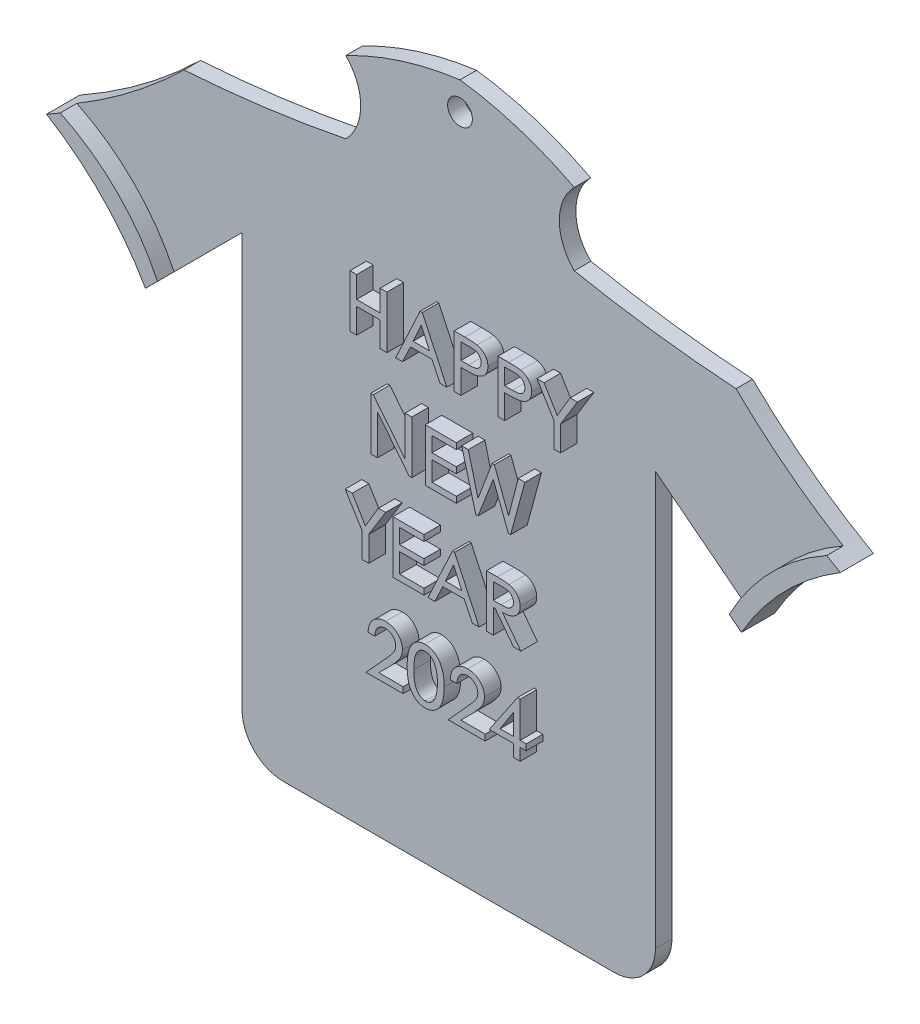
from build123d import *

# Parameters (mm, degrees)
BOSS_EXTRUDE1_DEPTH = 5
SKETCH4_R           = 1.5
CUT_EXTRUDE1_DEPTH  = 5
BOSS_EXTRUDE2_DEPTH = 2
BOSS_EXTRUDE3_DEPTH = 2
CUT_EXTRUDE2_DEPTH  = 3


with BuildPart() as part:
    # Sketch2 → Boss-Extrude1 (new body)
    with BuildSketch(Plane.XY):
        with BuildLine():
            Line((0, 55), (-9.681818182, 45.318181818))
            ThreePointArc((-9.681818182, 45.318181818), (-14.887109435, 52.206720352), (-21.650081289, 57.574143557))
            ThreePointArc((-21.650081289, 57.574143557), (-13.979715501, 62.568990284), (-7.026662114, 68.521977243))
            ThreePointArc((-7.026662114, 68.521977243), (2.800987049, 69.489571918), (12.545454545, 71.090909091))
            ThreePointArc((12.545454545, 71.090909091), (14.352931909, 75.454545455), (12.545454545, 79.818181818))
            ThreePointArc((12.545454545, 79.818181818), (19.262496668, 82.608154491), (26.363636364, 84.181818182))
            ThreePointArc((26.363636364, 84.181818182), (33.464776059, 82.608154491), (40.181818182, 79.818181818))
            ThreePointArc((40.181818182, 79.818181818), (38.374340819, 75.454545455), (40.181818182, 71.090909091))
            ThreePointArc((40.181818182, 71.090909091), (49.926285678, 69.489571918), (59.753934841, 68.521977243))
            ThreePointArc((59.753934841, 68.521977243), (66.706988228, 62.568990284), (74.377354016, 57.574143557))
            ThreePointArc((74.377354016, 57.574143557), (67.614382163, 52.206720352), (62.409090909, 45.318181818))
            Line((62.409090909, 45.318181818), (50, 55))
            Line((50, 55), (50, 5))
            ThreePointArc((50, 5), (48.535533906, 1.464466094), (45, 0))
            Line((45, 0), (5, 0))
            ThreePointArc((5, 0), (1.464466094, 1.464466094), (0, 5))
            Line((0, 5), (0, 55))
        make_face()
    extrude(amount=BOSS_EXTRUDE1_DEPTH)

    # Sketch4 → Cut-Extrude1 (cut)
    with BuildSketch(Plane.XY.offset(5)):
        with Locations((26.363636364, 80.815512025)):
            Circle(SKETCH4_R)
    extrude(amount=-CUT_EXTRUDE1_DEPTH, mode=Mode.SUBTRACT)

    # Sketch5 → Boss-Extrude2 (add)
    # profile 1 of 16: a face of its own
    with BuildSketch(Plane.XY.offset(5)):
        Polygon((15.047921928, 59.532880786), (15.862024492, 59.532880786), (15.862024492, 56.927752581), (18.711383467, 56.927752581), (18.711383467, 59.532880786), (19.525486031, 59.532880786), (19.525486031, 53.182880786), (18.711383467, 53.182880786), (18.711383467, 56.195060273), (15.862024492, 56.195060273), (15.862024492, 53.182880786), (15.047921928, 53.182880786), align=None)
    # profile 2 of 16: a face of its own
    with BuildSketch(Plane.XY.offset(5)):
        Polygon((23.799524492, 59.532880786), (26.770998851, 53.182880786), (25.935271688, 53.182880786), (24.971068963, 55.218137196), (22.37357297, 55.218137196), (21.409370246, 53.182880786), (20.583819364, 53.182880786), (23.545117441, 59.532880786), align=None)
        Polygon((23.672320967, 58.145090321), (22.683949572, 55.950829504), (24.670868643, 55.950829504), align=None, mode=Mode.SUBTRACT)
    # profile 3 of 16: a face of its own
    with BuildSketch(Plane.XY.offset(5)):
        with BuildLine():
            Line((27.666511672, 59.532880786), (28.967803739, 59.532880786))
            add(Edge.make_bspline(
                [(28.967803739, 59.532880786), (29.053883131, 59.532833891), (29.218850574, 59.53274402), (29.45543153, 59.526654045), (29.67006373, 59.521397891), (29.863064306, 59.511295115), (30.033993841, 59.497456249), (30.182913697, 59.4811834), (30.309983771, 59.46288094), (30.386616983, 59.446334056), (30.421740037, 59.438750177)],
                knots=[0, 0, 0, 0, 1.415450773, 2.712650385, 3.891531898, 4.945867971, 5.890285756, 6.71109784, 7.409261617, 8, 8, 8, 8], degree=3))
            add(Edge.make_bspline(
                [(30.421740037, 59.438750177), (30.471184061, 59.426035366), (30.568721965, 59.400952943), (30.708156028, 59.34925065), (30.840460118, 59.290501653), (30.965182525, 59.223672681), (31.081049258, 59.146488802), (31.190560085, 59.062629726), (31.290346616, 58.967853979), (31.383827456, 58.866759343), (31.465848084, 58.757036736), (31.539338803, 58.64239884), (31.600251432, 58.521180572), (31.650311307, 58.393832822), (31.689444922, 58.261019556), (31.717594296, 58.12231761), (31.73450895, 57.978031135), (31.736175619, 57.879705233), (31.737024492, 57.829625577)],
                knots=[0, 0, 0, 0, 1.085641105, 2.141637125, 3.15936318, 4.164535163, 5.147931294, 6.118832473, 7.09541784, 8.072503165, 9.045079613, 10.006206652, 10.966486436, 11.926469503, 12.914201526, 13.908586125, 14.934794539, 16, 16, 16, 16], degree=3))
            add(Edge.make_bspline(
                [(31.737024492, 57.829625577), (31.736156995, 57.779548255), (31.734446461, 57.680805549), (31.717638619, 57.53565651), (31.689463736, 57.396666427), (31.651478741, 57.263221287), (31.60155803, 57.136151007), (31.541906913, 57.014382814), (31.469800152, 56.899296314), (31.387481782, 56.790092684), (31.294520852, 56.688450149), (31.192264624, 56.594754505), (31.07936897, 56.510642107), (30.956991768, 56.434603227), (30.825559442, 56.36530448), (30.683749772, 56.305699952), (30.532195439, 56.254911217), (30.427013313, 56.227905455), (30.373402697, 56.214140802)],
                knots=[0, 0, 0, 0, 1.042501879, 2.055610221, 3.037454288, 3.993184118, 4.940927036, 5.876790881, 6.812738028, 7.76458517, 8.720845088, 9.677105007, 10.648370915, 11.647960469, 12.67482723, 13.739162042, 14.847666245, 16, 16, 16, 16], degree=3))
            add(Edge.make_bspline(
                [(30.373402697, 56.214140802), (30.334056679, 56.205610302), (30.248224151, 56.187001192), (30.105790236, 56.16763708), (29.939825649, 56.151772856), (29.749805849, 56.137970688), (29.536509725, 56.126376743), (29.298991184, 56.119475146), (29.037791939, 56.113906068), (28.855444278, 56.113737711), (28.760461992, 56.113650016)],
                knots=[0, 0, 0, 0, 0.596754895, 1.30180848, 2.129432098, 3.068723067, 4.126429569, 5.296393252, 6.591729958, 8, 8, 8, 8], degree=3))
            Line((28.760461992, 56.113650016), (28.480614236, 56.113650016))
            Line((28.480614236, 56.113650016), (28.480614236, 53.182880786))
            Line((28.480614236, 53.182880786), (27.666511672, 53.182880786))
            Line((27.666511672, 53.182880786), (27.666511672, 59.532880786))
        make_face()
        with BuildLine():
            Line((28.480614236, 58.800188478), (28.480614236, 56.843798254))
            Line((28.480614236, 56.843798254), (29.396479621, 56.833621972))
            add(Edge.make_bspline(
                [(29.396479621, 56.833621972), (29.448210988, 56.834304118), (29.547881044, 56.8356184), (29.691712724, 56.840181741), (29.824007324, 56.849456423), (29.945020391, 56.860273312), (30.054996389, 56.875438641), (30.153440213, 56.894365705), (30.241191266, 56.915631287), (30.341535845, 56.949065489), (30.453855925, 57.001270348), (30.573264441, 57.080924166), (30.67851893, 57.176184262), (30.765443265, 57.288305209), (30.835396369, 57.41184043), (30.887394278, 57.543876775), (30.91682603, 57.684169677), (30.920872747, 57.779885075), (30.922921928, 57.828353542)],
                knots=[0, 0, 0, 0, 1.196816259, 2.305888068, 3.328295896, 4.264290022, 5.116006351, 5.89509982, 6.582615619, 7.202969204, 8.339503699, 9.435837163, 10.511976311, 11.608836183, 12.702577786, 13.786378287, 14.879063815, 16, 16, 16, 16], degree=3))
            add(Edge.make_bspline(
                [(30.922921928, 57.828353542), (30.920857945, 57.875130584), (30.916764111, 57.967911089), (30.887178512, 58.104367601), (30.835156605, 58.233800828), (30.765089562, 58.355600708), (30.67994494, 58.466927624), (30.579087084, 58.562696299), (30.464943911, 58.640965983), (30.358382477, 58.691096332), (30.263366564, 58.723720236), (30.179623697, 58.742884502), (30.085019843, 58.760802825), (29.97896754, 58.776163868), (29.861368123, 58.787242505), (29.732363354, 58.794348851), (29.592420901, 58.799917788), (29.495280742, 58.800095933), (29.44481696, 58.800188478)],
                knots=[0, 0, 0, 0, 1.113934591, 2.209447376, 3.306634974, 4.424089692, 5.547326231, 6.633252657, 7.723023745, 8.829884498, 9.427152571, 10.113060991, 10.873719268, 11.720735618, 12.664423995, 13.686322671, 14.798057257, 16, 16, 16, 16], degree=3))
            Line((29.44481696, 58.800188478), (28.480614236, 58.800188478))
        make_face(mode=Mode.SUBTRACT)
    # profile 4 of 16: a face of its own
    with BuildSketch(Plane.XY.offset(5)):
        with BuildLine():
            Line((32.958178338, 59.532880786), (34.259470406, 59.532880786))
            add(Edge.make_bspline(
                [(34.259470406, 59.532880786), (34.345549797, 59.532833891), (34.51051724, 59.53274402), (34.747098196, 59.526654045), (34.961730397, 59.521397891), (35.154730972, 59.511295115), (35.325660508, 59.497456249), (35.474580364, 59.4811834), (35.601650437, 59.46288094), (35.67828365, 59.446334056), (35.713406704, 59.438750177)],
                knots=[0, 0, 0, 0, 1.415450773, 2.712650385, 3.891531898, 4.945867971, 5.890285756, 6.71109784, 7.409261617, 8, 8, 8, 8], degree=3))
            add(Edge.make_bspline(
                [(35.713406704, 59.438750177), (35.762850728, 59.426035366), (35.860388632, 59.400952943), (35.999822695, 59.34925065), (36.132126785, 59.290501653), (36.256849191, 59.223672681), (36.372715925, 59.146488802), (36.482226751, 59.062629726), (36.582013282, 58.967853979), (36.675494123, 58.866759343), (36.757514751, 58.757036736), (36.83100547, 58.64239884), (36.891918099, 58.521180572), (36.941977974, 58.393832822), (36.981111589, 58.261019556), (37.009260962, 58.12231761), (37.026175617, 57.978031135), (37.027842286, 57.879705233), (37.028691159, 57.829625577)],
                knots=[0, 0, 0, 0, 1.085641105, 2.141637125, 3.15936318, 4.164535163, 5.147931294, 6.118832473, 7.09541784, 8.072503165, 9.045079613, 10.006206652, 10.966486436, 11.926469503, 12.914201526, 13.908586125, 14.934794539, 16, 16, 16, 16], degree=3))
            add(Edge.make_bspline(
                [(37.028691159, 57.829625577), (37.027823662, 57.779548255), (37.026113128, 57.680805549), (37.009305286, 57.53565651), (36.981130402, 57.396666427), (36.943145407, 57.263221287), (36.893224697, 57.136151007), (36.83357358, 57.014382814), (36.761466819, 56.899296314), (36.679148449, 56.790092684), (36.586187519, 56.688450149), (36.483931291, 56.594754505), (36.371035637, 56.510642107), (36.248658435, 56.434603227), (36.117226109, 56.36530448), (35.975416439, 56.305699952), (35.823862106, 56.254911217), (35.71867998, 56.227905455), (35.665069364, 56.214140802)],
                knots=[0, 0, 0, 0, 1.042501879, 2.055610221, 3.037454288, 3.993184118, 4.940927036, 5.876790881, 6.812738028, 7.76458517, 8.720845088, 9.677105007, 10.648370915, 11.647960469, 12.67482723, 13.739162042, 14.847666245, 16, 16, 16, 16], degree=3))
            add(Edge.make_bspline(
                [(35.665069364, 56.214140802), (35.625723345, 56.205610302), (35.539890818, 56.187001192), (35.397456903, 56.16763708), (35.231492316, 56.151772856), (35.041472516, 56.137970688), (34.828176391, 56.126376743), (34.590657851, 56.119475146), (34.329458606, 56.113906068), (34.147110945, 56.113737711), (34.052128659, 56.113650016)],
                knots=[0, 0, 0, 0, 0.596754895, 1.30180848, 2.129432098, 3.068723067, 4.126429569, 5.296393252, 6.591729958, 8, 8, 8, 8], degree=3))
            Line((34.052128659, 56.113650016), (33.772280903, 56.113650016))
            Line((33.772280903, 56.113650016), (33.772280903, 53.182880786))
            Line((33.772280903, 53.182880786), (32.958178338, 53.182880786))
            Line((32.958178338, 53.182880786), (32.958178338, 59.532880786))
        make_face()
        with BuildLine():
            Line((33.772280903, 58.800188478), (33.772280903, 56.843798254))
            Line((33.772280903, 56.843798254), (34.688146287, 56.833621972))
            add(Edge.make_bspline(
                [(34.688146287, 56.833621972), (34.739877655, 56.834304118), (34.839547711, 56.8356184), (34.983379391, 56.840181741), (35.11567399, 56.849456423), (35.236687058, 56.860273312), (35.346663056, 56.875438641), (35.44510688, 56.894365705), (35.532857933, 56.915631287), (35.633202511, 56.949065489), (35.745522592, 57.001270348), (35.864931107, 57.080924166), (35.970185597, 57.176184262), (36.057109931, 57.288305209), (36.127063036, 57.41184043), (36.179060945, 57.543876775), (36.208492696, 57.684169677), (36.212539414, 57.779885075), (36.214588595, 57.828353542)],
                knots=[0, 0, 0, 0, 1.196816259, 2.305888068, 3.328295896, 4.264290022, 5.116006351, 5.89509982, 6.582615619, 7.202969204, 8.339503699, 9.435837163, 10.511976311, 11.608836183, 12.702577786, 13.786378287, 14.879063815, 16, 16, 16, 16], degree=3))
            add(Edge.make_bspline(
                [(36.214588595, 57.828353542), (36.212524611, 57.875130584), (36.208430778, 57.967911089), (36.178845178, 58.104367601), (36.126823272, 58.233800828), (36.056756228, 58.355600708), (35.971611606, 58.466927624), (35.870753751, 58.562696299), (35.756610578, 58.640965983), (35.650049144, 58.691096332), (35.55503323, 58.723720236), (35.471290363, 58.742884502), (35.37668651, 58.760802825), (35.270634207, 58.776163868), (35.15303479, 58.787242505), (35.02403002, 58.794348851), (34.884087568, 58.799917788), (34.786947409, 58.800095933), (34.736483627, 58.800188478)],
                knots=[0, 0, 0, 0, 1.113934591, 2.209447376, 3.306634974, 4.424089692, 5.547326231, 6.633252657, 7.723023745, 8.829884498, 9.427152571, 10.113060991, 10.873719268, 11.720735618, 12.664423995, 13.686322671, 14.798057257, 16, 16, 16, 16], degree=3))
            Line((34.736483627, 58.800188478), (33.772280903, 58.800188478))
        make_face(mode=Mode.SUBTRACT)
    # profile 5 of 16: a face of its own
    with BuildSketch(Plane.XY.offset(5)):
        Polygon((37.67997321, 59.532880786), (38.533508867, 59.532880786), (40.115920726, 56.90103984), (41.69706055, 59.532880786), (42.564588595, 59.532880786), (40.529332185, 56.223045048), (40.529332185, 53.182880786), (39.715229621, 53.182880786), (39.715229621, 56.200148414), align=None)
    # profile 6 of 16: a face of its own
    with BuildSketch(Plane.XY.offset(5)):
        Polygon((17.571639877, 41.599547452), (17.571639877, 47.949547452), (17.873112233, 47.949547452), (21.723562954, 43.124717725), (21.723562954, 47.949547452), (22.537665518, 47.949547452), (22.537665518, 41.599547452), (22.204392281, 41.599547452), (18.385742441, 46.411656827), (18.385742441, 41.599547452), align=None)
    # profile 7 of 16: a face of its own
    with BuildSketch(Plane.XY.offset(5)):
        Polygon((24.165870646, 47.949547452), (27.910742441, 47.949547452), (27.910742441, 47.216855145), (24.97997321, 47.216855145), (24.97997321, 45.425829504), (27.910742441, 45.425829504), (27.910742441, 44.693137196), (24.97997321, 44.693137196), (24.97997321, 42.33223976), (27.910742441, 42.33223976), (27.910742441, 41.599547452), (24.165870646, 41.599547452), align=None)
    # profile 8 of 16: a face of its own
    with BuildSketch(Plane.XY.offset(5)):
        Polygon((28.562024492, 47.949547452), (29.371038915, 47.949547452), (30.534951175, 43.412197693), (32.258558947, 47.949547452), (32.524414316, 47.949547452), (34.235301736, 43.42110194), (35.405574172, 47.949547452), (36.214588595, 47.949547452), (34.487164717, 41.599547452), (34.209861031, 41.599547452), (32.384490438, 46.334062677), (30.547671528, 41.599547452), (30.272911912, 41.599547452), align=None)
    # profile 9 of 16: a face of its own
    with BuildSketch(Plane.XY.offset(5)):
        Polygon((14.478050133, 36.366214119), (15.33158579, 36.366214119), (16.913997649, 33.734373173), (18.495137473, 36.366214119), (19.362665518, 36.366214119), (17.327409108, 33.056378382), (17.327409108, 30.016214119), (16.513306544, 30.016214119), (16.513306544, 33.033481747), align=None)
    # profile 10 of 16: a face of its own
    with BuildSketch(Plane.XY.offset(5)):
        Polygon((20.258178338, 36.366214119), (24.003050133, 36.366214119), (24.003050133, 35.633521811), (21.072280903, 35.633521811), (21.072280903, 33.84249617), (24.003050133, 33.84249617), (24.003050133, 33.109803863), (21.072280903, 33.109803863), (21.072280903, 30.748906427), (24.003050133, 30.748906427), (24.003050133, 30.016214119), (20.258178338, 30.016214119), align=None)
    # profile 11 of 16: a face of its own
    with BuildSketch(Plane.XY.offset(5)):
        Polygon((27.7072168, 36.366214119), (30.678691159, 30.016214119), (29.842963996, 30.016214119), (28.878761271, 32.051470529), (26.281265278, 32.051470529), (25.317062553, 30.016214119), (24.491511672, 30.016214119), (27.452809749, 36.366214119), align=None)
        Polygon((27.580013274, 34.978423654), (26.59164188, 32.784162837), (28.578560951, 32.784162837), align=None, mode=Mode.SUBTRACT)
    # profile 12 of 16: a face of its own
    with BuildSketch(Plane.XY.offset(5)):
        with BuildLine():
            Line((31.574203979, 36.366214119), (32.874224012, 36.366214119))
            add(Edge.make_bspline(
                [(32.874224012, 36.366214119), (32.957756991, 36.366012143), (33.117624137, 36.365625598), (33.347020824, 36.361569331), (33.555306912, 36.356197165), (33.742639821, 36.344975489), (33.909521205, 36.335070279), (34.055229275, 36.318778984), (34.180450038, 36.304248913), (34.255736636, 36.288262917), (34.289999252, 36.280987757)],
                knots=[0, 0, 0, 0, 1.411347063, 2.701065231, 3.876524531, 4.931206492, 5.871916627, 6.700262025, 7.408494688, 8, 8, 8, 8], degree=3))
            add(Edge.make_bspline(
                [(34.289999252, 36.280987757), (34.341087422, 36.268144836), (34.441738899, 36.242842325), (34.586747339, 36.193027045), (34.723648286, 36.134298404), (34.852261304, 36.066979411), (34.972895629, 35.990731934), (35.083217392, 35.903255762), (35.187572611, 35.809019261), (35.281934753, 35.705065863), (35.367790031, 35.594523699), (35.44119854, 35.47741225), (35.504183689, 35.355304327), (35.556751886, 35.228381445), (35.596057995, 35.095228229), (35.623589647, 34.956824667), (35.642537168, 34.813581811), (35.643985626, 34.71602247), (35.6447168, 34.666775016)],
                knots=[0, 0, 0, 0, 1.103820101, 2.174693741, 3.209859002, 4.223626675, 5.214778413, 6.196198804, 7.171320727, 8.158999421, 9.134971582, 10.10159085, 11.051641808, 12.012235658, 12.97676874, 13.956376421, 14.968389326, 16, 16, 16, 16], degree=3))
            add(Edge.make_bspline(
                [(35.6447168, 34.666775016), (35.641994908, 34.585554987), (35.636645469, 34.425930191), (35.58802968, 34.193129371), (35.508362072, 33.973680503), (35.417492907, 33.802252305), (35.329093548, 33.674805919), (35.255083897, 33.584201315), (35.173718323, 33.499318786), (35.085573759, 33.419274622), (34.988330546, 33.347606031), (34.884955228, 33.27965299), (34.774228352, 33.217184981), (34.614621493, 33.142176644), (34.398743864, 33.063996802), (34.119813469, 32.996973098), (33.818408056, 32.956260845), (33.610013506, 32.950138654), (33.502609428, 32.94698335)],
                knots=[0, 0, 0, 0, 1.258986715, 2.474334223, 3.670931197, 4.871716255, 5.472099774, 6.075216246, 6.684756624, 7.295006596, 7.919971941, 8.55677058, 9.213641309, 9.890468445, 11.291088691, 12.766994829, 14.333747493, 16, 16, 16, 16], degree=3))
            Line((33.502609428, 32.94698335), (35.726127056, 30.016214119))
            Line((35.726127056, 30.016214119), (34.829342201, 30.016214119))
            Line((34.829342201, 30.016214119), (32.605824572, 32.94698335))
            Line((32.605824572, 32.94698335), (32.388306544, 32.94698335))
            Line((32.388306544, 32.94698335), (32.388306544, 30.016214119))
            Line((32.388306544, 30.016214119), (31.574203979, 30.016214119))
            Line((31.574203979, 30.016214119), (31.574203979, 36.366214119))
        make_face()
        with BuildLine():
            Line((32.388306544, 35.633521811), (32.388306544, 33.678403622))
            Line((32.388306544, 33.678403622), (33.321980422, 33.672043446))
            add(Edge.make_bspline(
                [(33.321980422, 33.672043446), (33.372018496, 33.672172734), (33.468731388, 33.67242262), (33.608721622, 33.677568105), (33.738565944, 33.686184368), (33.857751458, 33.698945566), (33.965932467, 33.714170104), (34.063938212, 33.731221716), (34.150848439, 33.754246834), (34.252370499, 33.787436707), (34.365162786, 33.840759375), (34.484814499, 33.921945354), (34.589693449, 34.018026968), (34.675699619, 34.130609623), (34.744513751, 34.254125193), (34.794574459, 34.386002649), (34.824730654, 34.525498642), (34.828630719, 34.620833264), (34.830614236, 34.669319087)],
                knots=[0, 0, 0, 0, 1.165824803, 2.253289887, 3.263370799, 4.197285623, 5.045371766, 5.808848116, 6.513348392, 7.138183875, 8.296069948, 9.40583476, 10.496436725, 11.595152671, 12.691956992, 13.780050175, 14.870965332, 16, 16, 16, 16], degree=3))
            add(Edge.make_bspline(
                [(34.830614236, 34.669319087), (34.828536882, 34.716090552), (34.824416529, 34.808859993), (34.795110809, 34.945010979), (34.742727726, 35.073456207), (34.673227297, 35.19403057), (34.587112904, 35.302425772), (34.488079387, 35.397940646), (34.373675134, 35.473649477), (34.268348702, 35.52474785), (34.173953096, 35.556794831), (34.09036974, 35.576585699), (33.99523278, 35.594060526), (33.888347832, 35.609419427), (33.769912434, 35.6206408), (33.639631155, 35.627700504), (33.497568287, 35.633247419), (33.398732818, 35.63342804), (33.347421127, 35.633521811)],
                knots=[0, 0, 0, 0, 1.114111647, 2.20979856, 3.297775031, 4.406653707, 5.514151176, 6.585969385, 7.670234779, 8.768154562, 9.365517569, 10.041721951, 10.812428959, 11.669578816, 12.61341719, 13.645562296, 14.777663698, 16, 16, 16, 16], degree=3))
            Line((33.347421127, 35.633521811), (32.388306544, 35.633521811))
        make_face(mode=Mode.SUBTRACT)
    # profile 13 of 16: a face of its own
    with BuildSketch(Plane.XY.offset(5)):
        with BuildLine():
            Line((18.051197169, 22.747624375), (17.245998851, 22.747624375))
            add(Edge.make_bspline(
                [(17.245998851, 22.747624375), (17.24978111, 22.829557634), (17.257178689, 22.989807846), (17.290027756, 23.22331031), (17.343240903, 23.443329195), (17.410407129, 23.651729673), (17.500005002, 23.845906629), (17.603383025, 24.029245063), (17.728184051, 24.197902564), (17.869216028, 24.352145933), (18.022311221, 24.492282036), (18.186889269, 24.613118736), (18.360168298, 24.716089447), (18.542182382, 24.80011423), (18.733287976, 24.865173014), (18.932940355, 24.912514661), (19.141776434, 24.940989537), (19.284134698, 24.944116193), (19.356305342, 24.945701298)],
                knots=[0, 0, 0, 0, 1.154964179, 2.258951466, 3.315045469, 4.34063582, 5.337653555, 6.322213479, 7.300594401, 8.285733883, 9.262436119, 10.219305053, 11.156568068, 12.097250375, 13.037875795, 13.995471444, 14.983774372, 16, 16, 16, 16], degree=3))
            add(Edge.make_bspline(
                [(19.356305342, 24.945701298), (19.431868161, 24.94415561), (19.580143307, 24.941122543), (19.796067633, 24.91258101), (20.000420242, 24.866557809), (20.19326097, 24.803706662), (20.374238473, 24.719784011), (20.543709629, 24.618582549), (20.700045398, 24.496942047), (20.844380456, 24.36083392), (20.971865633, 24.211113859), (21.087010932, 24.057183852), (21.18218967, 23.895922022), (21.26192546, 23.730273047), (21.323283407, 23.558877376), (21.366614198, 23.382432515), (21.392587398, 23.200818566), (21.396132463, 23.078013108), (21.397921928, 23.016023815)],
                knots=[0, 0, 0, 0, 1.156722346, 2.269809107, 3.328396062, 4.361258308, 5.3694338, 6.377253737, 7.377324894, 8.397019439, 9.4098266, 10.385180797, 11.337325354, 12.27255833, 13.196816462, 14.119704983, 15.050871513, 16, 16, 16, 16], degree=3))
            add(Edge.make_bspline(
                [(21.397921928, 23.016023815), (21.394665643, 22.929310966), (21.38819768, 22.757073165), (21.338392365, 22.502257224), (21.254663795, 22.2556486), (21.157949286, 22.054844501), (21.060134228, 21.892531687), (20.97037002, 21.758557035), (20.864920298, 21.613689767), (20.741523642, 21.458899634), (20.605086803, 21.290644978), (20.450189975, 21.113266247), (20.281627447, 20.923172284), (20.161411275, 20.795171799), (20.099173931, 20.728904423)],
                knots=[0, 0, 0, 0, 1.155755081, 2.295677249, 3.447123235, 4.6205014, 5.259503175, 5.973005395, 6.77029923, 7.648035671, 8.612336498, 9.658570495, 10.787814065, 12, 12, 12, 12], degree=3))
            Line((20.099173931, 20.728904423), (18.537114637, 19.165573093))
            Line((18.537114637, 19.165573093), (21.479332185, 19.165573093))
            Line((21.479332185, 19.165573093), (21.479332185, 18.432880786))
            Line((21.479332185, 18.432880786), (17.001768082, 18.432880786))
            Line((17.001768082, 18.432880786), (19.431355422, 21.115603141))
            add(Edge.make_bspline(
                [(19.431355422, 21.115603141), (19.489224972, 21.177320368), (19.600277695, 21.295756854), (19.756790787, 21.469128851), (19.898000634, 21.629408557), (20.024660081, 21.776480266), (20.133452434, 21.912320778), (20.227304423, 22.034931643), (20.305153626, 22.144891852), (20.386000395, 22.274324171), (20.46611125, 22.429478325), (20.534260105, 22.618744607), (20.575152756, 22.812026536), (20.580929081, 22.942056735), (20.583819364, 23.007119568)],
                knots=[0, 0, 0, 0, 1.341560447, 2.574479018, 3.703506985, 4.728875774, 5.651874962, 6.462761537, 7.177175968, 7.787249671, 8.88179658, 9.938774664, 10.968630673, 12, 12, 12, 12], degree=3))
            add(Edge.make_bspline(
                [(20.583819364, 23.007119568), (20.583107077, 23.047482086), (20.581697673, 23.127347502), (20.562482766, 23.244300827), (20.535415119, 23.357739044), (20.493550936, 23.465838409), (20.443112299, 23.570725659), (20.380022537, 23.671044898), (20.304262951, 23.765865556), (20.219987541, 23.857321039), (20.126776723, 23.939894981), (20.028323824, 24.013951729), (19.92341811, 24.074095443), (19.814927863, 24.126692173), (19.699480597, 24.163979814), (19.579914145, 24.191742379), (19.45528967, 24.210974069), (19.37037183, 24.21232154), (19.327048531, 24.213008991)],
                knots=[0, 0, 0, 0, 0.999432927, 1.977580462, 2.931018689, 3.885672852, 4.844657058, 5.812871023, 6.815890212, 7.849665183, 8.891901864, 9.898878619, 10.897592748, 11.885014695, 12.882178885, 13.896915602, 14.927050508, 16, 16, 16, 16], degree=3))
            add(Edge.make_bspline(
                [(19.327048531, 24.213008991), (19.285861289, 24.212164233), (19.204835171, 24.210502371), (19.085504157, 24.193355812), (18.970961158, 24.165437841), (18.860819769, 24.12671307), (18.754282257, 24.078937911), (18.653953642, 24.017045285), (18.558194084, 23.945045092), (18.465737617, 23.864235713), (18.38159157, 23.769430223), (18.306329181, 23.661752088), (18.239869521, 23.541083979), (18.183062837, 23.407636991), (18.135984363, 23.261061024), (18.098218179, 23.101534308), (18.069021269, 22.928987418), (18.057248446, 22.80919708), (18.051197169, 22.747624375)],
                knots=[0, 0, 0, 0, 0.911540883, 1.79324023, 2.663162255, 3.518366492, 4.375475705, 5.243419306, 6.122264358, 7.02676621, 7.957780629, 8.921596253, 9.930241338, 11.002848587, 12.128200329, 13.335197372, 14.630280975, 16, 16, 16, 16], degree=3))
        make_face()
    # profile 14 of 16: a face of its own
    with BuildSketch(Plane.XY.offset(5)):
        with BuildLine():
            add(Edge.make_bspline(
                [(21.967793723, 21.605336715), (21.968399799, 21.706264004), (21.969576823, 21.902268739), (21.982259769, 22.187405427), (22.004138791, 22.455049017), (22.032241624, 22.705207451), (22.071121149, 22.938052602), (22.115607379, 23.153699535), (22.170368566, 23.352174779), (22.234331509, 23.533832494), (22.30614903, 23.701898981), (22.385112735, 23.858479432), (22.47072251, 24.005561839), (22.562400152, 24.143094974), (22.664479906, 24.268014792), (22.770968996, 24.384599438), (22.885865837, 24.490573085), (23.008117502, 24.585405188), (23.134580275, 24.671142477), (23.266749487, 24.743407579), (23.401562721, 24.806357369), (23.540739149, 24.857278285), (23.683269677, 24.896834129), (23.829664754, 24.924458179), (23.979228255, 24.943481278), (24.080584651, 24.944958737), (24.131525694, 24.945701298)],
                knots=[0, 0, 0, 0, 1.622528522, 3.151013738, 4.587225782, 5.939257941, 7.196658267, 8.381214254, 9.47772444, 10.503964975, 11.475138444, 12.414102326, 13.321377868, 14.209997518, 15.068075989, 15.912287155, 16.746865696, 17.577313739, 18.397854368, 19.200328723, 19.996378645, 20.787862277, 21.580050128, 22.371504404, 23.181529048, 24, 24, 24, 24], degree=3))
            add(Edge.make_bspline(
                [(24.131525694, 24.945701298), (24.187096809, 24.944237891), (24.296784321, 24.941349384), (24.459565878, 24.925629956), (24.616889748, 24.893871481), (24.77091449, 24.854045117), (24.919145288, 24.799601616), (25.064518409, 24.736994085), (25.202559351, 24.657695786), (25.337976412, 24.570954219), (25.46612654, 24.470924063), (25.588697053, 24.362234295), (25.701866481, 24.241174779), (25.809760055, 24.111911144), (25.906843456, 23.969380899), (25.999264035, 23.81857484), (26.081096558, 23.655737185), (26.158737767, 23.483748526), (26.225475003, 23.298035688), (26.285878584, 23.099659224), (26.334829078, 22.886147597), (26.375435157, 22.658164354), (26.406727904, 22.415325668), (26.429838398, 22.158208373), (26.441904299, 21.886572088), (26.44418617, 21.700749669), (26.445357826, 21.605336715)],
                knots=[0, 0, 0, 0, 0.875057392, 1.727207867, 2.570264412, 3.399251263, 4.229017074, 5.053828049, 5.887584622, 6.731829445, 7.583639997, 8.443960147, 9.308026848, 10.190032267, 11.091770676, 12.020167189, 12.972467704, 13.958579741, 14.989078804, 16.076606933, 17.221320015, 18.435081626, 19.720875061, 21.074561036, 22.497895074, 24, 24, 24, 24], degree=3))
            add(Edge.make_bspline(
                [(26.445357826, 21.605336715), (26.444173888, 21.510349241), (26.441868371, 21.325377296), (26.429975635, 21.054990723), (26.406266148, 20.799271795), (26.377073586, 20.557502777), (26.336126334, 20.330417934), (26.286268357, 20.1178973), (26.230356667, 19.918823502), (26.162007335, 19.734941254), (26.086324814, 19.56315571), (26.004214384, 19.401774103), (25.913782913, 19.250478409), (25.81365214, 19.110910165), (25.708593362, 18.978677726), (25.594042447, 18.858376898), (25.472087045, 18.747714671), (25.343022123, 18.648100367), (25.208324959, 18.558268274), (25.06715057, 18.482439133), (24.923057638, 18.415133219), (24.77282895, 18.364125285), (24.619509792, 18.320594198), (24.460518498, 18.292475439), (24.297330972, 18.273858422), (24.187123796, 18.271333874), (24.131525694, 18.270060273)],
                knots=[0, 0, 0, 0, 1.496607488, 2.914388442, 4.262485651, 5.541812885, 6.749953981, 7.895567619, 8.980172623, 10.005210728, 10.983286874, 11.936336572, 12.856292636, 13.757107149, 14.640766483, 15.514956722, 16.370989637, 17.232841377, 18.081413197, 18.918442167, 19.755471137, 20.583656588, 21.41504191, 22.264086897, 23.124254193, 24, 24, 24, 24], degree=3))
            add(Edge.make_bspline(
                [(24.131525694, 18.270060273), (24.080176325, 18.270932799), (23.978475238, 18.272660898), (23.828297262, 18.289609496), (23.682002364, 18.317738244), (23.540020219, 18.357161883), (23.401353236, 18.407214757), (23.266602762, 18.467846817), (23.136654476, 18.541264827), (23.010268246, 18.623756137), (22.889279632, 18.717583935), (22.776587086, 18.823632833), (22.669481108, 18.939368414), (22.570083544, 19.066038737), (22.476197845, 19.202826092), (22.391561283, 19.351019193), (22.312652545, 19.509035288), (22.239494235, 19.678091482), (22.173439178, 19.861125041), (22.120754321, 20.061716854), (22.071073014, 20.277678088), (22.034614086, 20.511193479), (22.002981254, 20.760501343), (21.984629239, 21.027220083), (21.96894603, 21.310465115), (21.968184868, 21.505244105), (21.967793723, 21.605336715)],
                knots=[0, 0, 0, 0, 0.82614074, 1.636230647, 2.42850654, 3.22151677, 4.005075515, 4.799112676, 5.596456327, 6.404618302, 7.226350817, 8.05679228, 8.892237205, 9.761873943, 10.645770802, 11.559890835, 12.505927976, 13.487073095, 14.523090282, 15.633895838, 16.822583925, 18.088023083, 19.435493537, 20.865857947, 22.389433785, 24, 24, 24, 24], degree=3))
        make_face()
        with BuildLine():
            add(Edge.make_bspline(
                [(22.781896287, 21.607880786), (22.782223278, 21.522644407), (22.782856308, 21.357633154), (22.792255801, 21.118854629), (22.805638141, 20.896514532), (22.825655965, 20.690673145), (22.852349082, 20.501024394), (22.883943031, 20.327830181), (22.919964875, 20.170758698), (22.963881552, 20.02955184), (23.012508717, 19.900890378), (23.066575867, 19.782441317), (23.122715647, 19.671521171), (23.185955398, 19.570328456), (23.252927857, 19.477480304), (23.324842354, 19.393330137), (23.399131648, 19.316033418), (23.505106716, 19.230202705), (23.640892542, 19.140466786), (23.809454487, 19.062653016), (23.979286599, 19.011288246), (24.093865754, 19.005579564), (24.150606223, 19.002752581)],
                knots=[0, 0, 0, 0, 1.564601651, 3.028951736, 4.386019676, 5.653114642, 6.824348509, 7.900668805, 8.88431448, 9.780488761, 10.613163047, 11.407444027, 12.169849642, 12.89344098, 13.595615509, 14.26934431, 14.924332585, 15.560171042, 16.769153194, 17.901006317, 18.960562374, 20, 20, 20, 20], degree=3))
            add(Edge.make_bspline(
                [(24.150606223, 19.002752581), (24.214904596, 19.006116895), (24.343101207, 19.012824586), (24.531903977, 19.061665061), (24.712934749, 19.143636917), (24.856375263, 19.236246586), (24.964750364, 19.326320794), (25.043016831, 19.403000919), (25.115155965, 19.488608989), (25.183257661, 19.581841399), (25.244835291, 19.684223302), (25.304210297, 19.793431011), (25.355907541, 19.912084591), (25.385785803, 19.994767752), (25.40101688, 20.036917244)],
                knots=[0, 0, 0, 0, 1.331887272, 2.655486065, 4.012646414, 5.436183829, 6.178803566, 6.930724497, 7.703763371, 8.496530827, 9.320959298, 10.178042319, 11.071218497, 12, 12, 12, 12], degree=3))
            add(Edge.make_bspline(
                [(25.40101688, 20.036917244), (25.419366814, 20.092295693), (25.456774426, 20.205188499), (25.503641022, 20.380955114), (25.542440794, 20.565387123), (25.57584956, 20.757502324), (25.601216886, 20.958268584), (25.618751037, 21.167492523), (25.628808879, 21.385175428), (25.630430736, 21.532820491), (25.631255262, 21.607880786)],
                knots=[0, 0, 0, 0, 0.877617242, 1.789083553, 2.735016418, 3.71249782, 4.722174671, 5.778575778, 6.870664861, 8, 8, 8, 8], degree=3))
            add(Edge.make_bspline(
                [(25.631255262, 21.607880786), (25.631057918, 21.682948767), (25.630673064, 21.829343898), (25.619234807, 22.043484157), (25.605401453, 22.247317107), (25.581536357, 22.440173348), (25.554827574, 22.623015328), (25.518192505, 22.794550357), (25.47889929, 22.956490879), (25.42981062, 23.106836777), (25.37614206, 23.247104586), (25.319537144, 23.377761203), (25.258333193, 23.498911176), (25.190900906, 23.609034383), (25.119728833, 23.709947384), (25.04455144, 23.801043282), (24.964248523, 23.881809319), (24.851982315, 23.97287475), (24.70725708, 24.067654112), (24.52629026, 24.152713596), (24.339423905, 24.202858722), (24.213216937, 24.209643228), (24.150606223, 24.213008991)],
                knots=[0, 0, 0, 0, 1.353201578, 2.638969622, 3.865559904, 5.035676431, 6.141732754, 7.195734042, 8.19695873, 9.144657206, 10.044788335, 10.904062871, 11.710933862, 12.489720227, 13.229995877, 13.935715626, 14.616825307, 15.279494989, 16.538995736, 17.725922936, 18.871840505, 20, 20, 20, 20], degree=3))
            add(Edge.make_bspline(
                [(24.150606223, 24.213008991), (24.093882116, 24.210126772), (23.978927106, 24.204285771), (23.808837252, 24.153634371), (23.64088211, 24.075203615), (23.506006188, 23.985405583), (23.400907542, 23.899665897), (23.325604034, 23.824127286), (23.25603306, 23.73950162), (23.188894659, 23.647400833), (23.127589832, 23.545542541), (23.068046621, 23.435784841), (23.015584904, 23.316314343), (22.966247696, 23.187554311), (22.922793584, 23.046089382), (22.885214836, 22.889257625), (22.851633681, 22.716254908), (22.827431855, 22.526223418), (22.807086975, 22.320069317), (22.791861024, 22.097380758), (22.782970921, 21.858121995), (22.782262316, 21.693114977), (22.781896287, 21.607880786)],
                knots=[0, 0, 0, 0, 1.039778295, 2.107176824, 3.232337611, 4.43520669, 5.071253539, 5.720927637, 6.389866065, 7.081397607, 7.811854436, 8.571243718, 9.372887587, 10.205834777, 11.102302774, 12.088086757, 13.166194718, 14.33675119, 15.604261439, 16.970055543, 18.43488556, 20, 20, 20, 20], degree=3))
        make_face(mode=Mode.SUBTRACT)
    # profile 15 of 16: a face of its own
    with BuildSketch(Plane.XY.offset(5)):
        with BuildLine():
            Line((27.983248451, 22.747624375), (27.178050133, 22.747624375))
            add(Edge.make_bspline(
                [(27.178050133, 22.747624375), (27.181832392, 22.829557634), (27.189229972, 22.989807846), (27.222079038, 23.22331031), (27.275292186, 23.443329195), (27.342458411, 23.651729673), (27.432056284, 23.845906629), (27.535434307, 24.029245063), (27.660235333, 24.197902564), (27.80126731, 24.352145933), (27.954362503, 24.492282036), (28.118940551, 24.613118736), (28.29221958, 24.716089447), (28.474233664, 24.80011423), (28.665339258, 24.865173014), (28.864991637, 24.912514661), (29.073827716, 24.940989537), (29.21618598, 24.944116193), (29.288356624, 24.945701298)],
                knots=[0, 0, 0, 0, 1.154964179, 2.258951466, 3.315045469, 4.34063582, 5.337653555, 6.322213479, 7.300594401, 8.285733883, 9.262436119, 10.219305053, 11.156568068, 12.097250375, 13.037875795, 13.995471444, 14.983774372, 16, 16, 16, 16], degree=3))
            add(Edge.make_bspline(
                [(29.288356624, 24.945701298), (29.363919443, 24.94415561), (29.512194589, 24.941122543), (29.728118915, 24.91258101), (29.932471524, 24.866557809), (30.125312252, 24.803706662), (30.306289755, 24.719784011), (30.475760911, 24.618582549), (30.63209668, 24.496942047), (30.776431738, 24.36083392), (30.903916916, 24.211113859), (31.019062214, 24.057183852), (31.114240952, 23.895922022), (31.193976742, 23.730273047), (31.255334689, 23.558877376), (31.29866548, 23.382432515), (31.32463868, 23.200818566), (31.328183745, 23.078013108), (31.32997321, 23.016023815)],
                knots=[0, 0, 0, 0, 1.156722346, 2.269809107, 3.328396062, 4.361258308, 5.3694338, 6.377253737, 7.377324894, 8.397019439, 9.4098266, 10.385180797, 11.337325354, 12.27255833, 13.196816462, 14.119704983, 15.050871513, 16, 16, 16, 16], degree=3))
            add(Edge.make_bspline(
                [(31.32997321, 23.016023815), (31.326716925, 22.929310966), (31.320248962, 22.757073165), (31.270443647, 22.502257224), (31.186715077, 22.2556486), (31.090000568, 22.054844501), (30.99218551, 21.892531687), (30.902421302, 21.758557035), (30.796971581, 21.613689767), (30.673574924, 21.458899634), (30.537138085, 21.290644978), (30.382241257, 21.113266247), (30.21367873, 20.923172284), (30.093462557, 20.795171799), (30.031225213, 20.728904423)],
                knots=[0, 0, 0, 0, 1.155755081, 2.295677249, 3.447123235, 4.6205014, 5.259503175, 5.973005395, 6.77029923, 7.648035671, 8.612336498, 9.658570495, 10.787814065, 12, 12, 12, 12], degree=3))
            Line((30.031225213, 20.728904423), (28.469165919, 19.165573093))
            Line((28.469165919, 19.165573093), (31.411383467, 19.165573093))
            Line((31.411383467, 19.165573093), (31.411383467, 18.432880786))
            Line((31.411383467, 18.432880786), (26.933819364, 18.432880786))
            Line((26.933819364, 18.432880786), (29.363406704, 21.115603141))
            add(Edge.make_bspline(
                [(29.363406704, 21.115603141), (29.421276254, 21.177320368), (29.532328977, 21.295756854), (29.688842069, 21.469128851), (29.830051916, 21.629408557), (29.956711363, 21.776480266), (30.065503716, 21.912320778), (30.159355705, 22.034931643), (30.237204908, 22.144891852), (30.318051677, 22.274324171), (30.398162532, 22.429478325), (30.466311387, 22.618744607), (30.507204039, 22.812026536), (30.512980363, 22.942056735), (30.515870646, 23.007119568)],
                knots=[0, 0, 0, 0, 1.341560447, 2.574479018, 3.703506985, 4.728875774, 5.651874962, 6.462761537, 7.177175968, 7.787249671, 8.88179658, 9.938774664, 10.968630673, 12, 12, 12, 12], degree=3))
            add(Edge.make_bspline(
                [(30.515870646, 23.007119568), (30.515158359, 23.047482086), (30.513748955, 23.127347502), (30.494534048, 23.244300827), (30.467466401, 23.357739044), (30.425602218, 23.465838409), (30.375163581, 23.570725659), (30.312073819, 23.671044898), (30.236314233, 23.765865556), (30.152038823, 23.857321039), (30.058828005, 23.939894981), (29.960375106, 24.013951729), (29.855469392, 24.074095443), (29.746979145, 24.126692173), (29.631531879, 24.163979814), (29.511965427, 24.191742379), (29.387340952, 24.210974069), (29.302423112, 24.21232154), (29.259099813, 24.213008991)],
                knots=[0, 0, 0, 0, 0.999432927, 1.977580462, 2.931018689, 3.885672852, 4.844657058, 5.812871023, 6.815890212, 7.849665183, 8.891901864, 9.898878619, 10.897592748, 11.885014695, 12.882178885, 13.896915602, 14.927050508, 16, 16, 16, 16], degree=3))
            add(Edge.make_bspline(
                [(29.259099813, 24.213008991), (29.217912571, 24.212164233), (29.136886453, 24.210502371), (29.017555439, 24.193355812), (28.90301244, 24.165437841), (28.792871052, 24.12671307), (28.68633354, 24.078937911), (28.586004924, 24.017045285), (28.490245366, 23.945045092), (28.397788899, 23.864235713), (28.313642852, 23.769430223), (28.238380463, 23.661752088), (28.171920803, 23.541083979), (28.115114119, 23.407636991), (28.068035645, 23.261061024), (28.030269461, 23.101534308), (28.001072551, 22.928987418), (27.989299728, 22.80919708), (27.983248451, 22.747624375)],
                knots=[0, 0, 0, 0, 0.911540883, 1.79324023, 2.663162255, 3.518366492, 4.375475705, 5.243419306, 6.122264358, 7.02676621, 7.957780629, 8.921596253, 9.930241338, 11.002848587, 12.128200329, 13.335197372, 14.630280975, 16, 16, 16, 16], degree=3))
        make_face()
    # profile 16 of 16: a face of its own
    with BuildSketch(Plane.XY.offset(5)):
        Polygon((35.32289188, 24.945701298), (35.6447168, 24.945701298), (35.6447168, 20.630957709), (36.377409108, 20.630957709), (36.377409108, 19.898265401), (35.6447168, 19.898265401), (35.6447168, 18.432880786), (34.830614236, 18.432880786), (34.830614236, 19.898265401), (31.899845005, 19.898265401), align=None)
        Polygon((34.830614236, 20.630957709), (34.830614236, 23.155947693), (33.213857425, 20.630957709), align=None, mode=Mode.SUBTRACT)
    extrude(amount=BOSS_EXTRUDE2_DEPTH)

    # Sketch6 → Boss-Extrude3 (add)
    with BuildSketch(Plane.XY.offset(5)):
        with BuildLine():
            ThreePointArc((-21.650081289, 57.574143557), (-14.887109435, 52.206720352), (-9.681818182, 45.318181818))
            Line((-9.681818182, 45.318181818), (-8.229459249, 46.770540751))
            ThreePointArc((-8.229459249, 46.770540751), (-13.099101053, 53.665006303), (-19.993566605, 58.534648107))
            ThreePointArc((-19.993566605, 58.534648107), (-20.818539486, 58.048731354), (-21.650081289, 57.574143557))
        make_face()
        with BuildLine():
            ThreePointArc((72.720839332, 58.534648107), (65.953571296, 53.35553354), (60.93366533, 46.469338039))
            Line((60.93366533, 46.469338039), (62.409090909, 45.318181818))
            ThreePointArc((62.409090909, 45.318181818), (67.614382163, 52.206720352), (74.377354016, 57.574143557))
            ThreePointArc((74.377354016, 57.574143557), (73.545812213, 58.048731354), (72.720839332, 58.534648107))
        make_face()
    extrude(amount=BOSS_EXTRUDE3_DEPTH)

    # Sketch7 → Cut-Extrude2 (cut)
    with BuildSketch(Plane(origin=(0, 0, 0), x_dir=(-1, 0, 0), z_dir=(0, 0, -1))):
        with BuildLine():
            Line((0, 55), (0, 5))
            ThreePointArc((0, 5), (-1.464466094, 1.464466094), (-5, 0))
            Line((-5, 0), (-45, 0))
            ThreePointArc((-45, 0), (-48.535533906, 1.464466094), (-50, 5))
            Line((-50, 5), (-50, 55))
            Line((-50, 55), (-62.409090909, 45.318181818))
            ThreePointArc((-62.409090909, 45.318181818), (-67.614382163, 52.206720352), (-74.377354016, 57.574143557))
            ThreePointArc((-74.377354016, 57.574143557), (-66.706988228, 62.568990284), (-59.753934841, 68.521977243))
            ThreePointArc((-59.753934841, 68.521977243), (-49.926285678, 69.489571918), (-40.181818182, 71.090909091))
            ThreePointArc((-40.181818182, 71.090909091), (-38.374340819, 75.454545455), (-40.181818182, 79.818181818))
            ThreePointArc((-40.181818182, 79.818181818), (-33.464776059, 82.608154491), (-26.363636364, 84.181818182))
            ThreePointArc((-26.363636364, 84.181818182), (-19.262496668, 82.608154491), (-12.545454545, 79.818181818))
            ThreePointArc((-12.545454545, 79.818181818), (-14.352931909, 75.454545455), (-12.545454545, 71.090909091))
            ThreePointArc((-12.545454545, 71.090909091), (-2.800987049, 69.489571918), (7.026662114, 68.521977243))
            ThreePointArc((7.026662114, 68.521977243), (13.979715501, 62.568990284), (21.650081289, 57.574143557))
            ThreePointArc((21.650081289, 57.574143557), (14.887109435, 52.206720352), (9.681818182, 45.318181818))
            Line((9.681818182, 45.318181818), (0, 55))
        make_face()
    extrude(amount=-CUT_EXTRUDE2_DEPTH, mode=Mode.SUBTRACT)


solid = part.part
